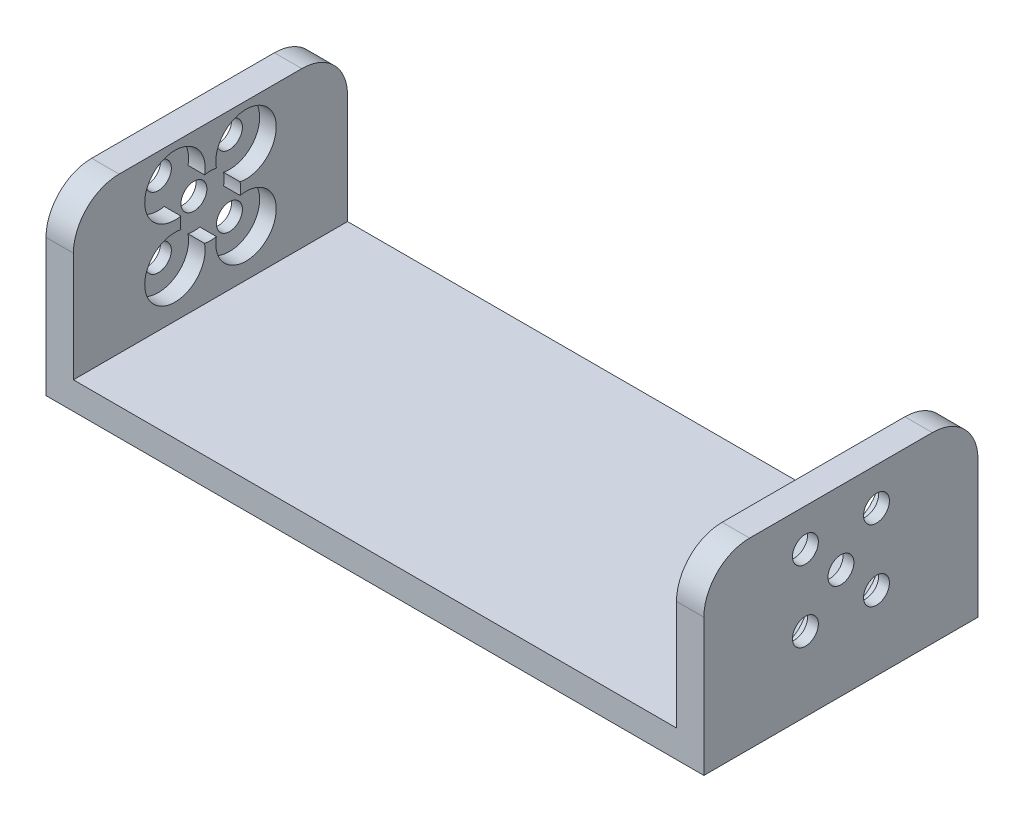
from build123d import *

# Parameters (mm, degrees)
SKETCH1_W                                        = 91.44
SKETCH1_H                                        = 38.1
BOSS_EXTRUDE1_DEPTH                              = 3.81
SKETCH2_W                                        = 38.1
SKETCH2_H                                        = 25.4
BOSS_EXTRUDE2_DEPTH                              = 3.81
CBORE_FOR_M3_HEX_HEAD_MACHINE_SCREW1_D           = 3.6
CBORE_FOR_M3_HEX_HEAD_MACHINE_SCREW1_DEPTH       = 3.81
CBORE_FOR_M3_HEX_HEAD_MACHINE_SCREW1_CBORE_D     = 8.4
CBORE_FOR_M3_HEX_HEAD_MACHINE_SCREW1_CBORE_DEPTH = 2.3
FILLET1_R                                        = 6.35
FILLET1_OF_MIRROR1_R                             = 6.35


with BuildPart() as part:
    # Sketch1 → Boss-Extrude1 (new body)
    with BuildSketch(Plane(origin=(0, 0, 0), x_dir=(1, 0, 0), z_dir=(0, 1, 0))):
        Rectangle(SKETCH1_W, SKETCH1_H)
    extrude(amount=BOSS_EXTRUDE1_DEPTH)

    # Sketch2 → Boss-Extrude2 (add)
    with BuildSketch(Plane.ZY.offset(45.72)):
        with Locations((0, 12.7)):
            Rectangle(SKETCH2_W, SKETCH2_H)
    boss_extrude2 = extrude(amount=-BOSS_EXTRUDE2_DEPTH)

    # CBORE for M3 Hex Head Machine Screw1
    with Locations(Plane(origin=(-41.91, 0, 0), x_dir=(0, 0, -1), z_dir=(1, 0, 0))):
        with Locations((-4.939140867, 20.179140867), (4.939140867, 20.179140867), (0, 15.24), (-4.939140867, 10.300859133), (4.939140867, 10.300859133)):
            cbore_for_m3_hex_head_machine_screw1 = CounterBoreHole(CBORE_FOR_M3_HEX_HEAD_MACHINE_SCREW1_D / 2, CBORE_FOR_M3_HEX_HEAD_MACHINE_SCREW1_CBORE_D / 2, CBORE_FOR_M3_HEX_HEAD_MACHINE_SCREW1_CBORE_DEPTH, depth=CBORE_FOR_M3_HEX_HEAD_MACHINE_SCREW1_DEPTH)

    # Fillet1
    fillet1_edges = [part.edges().sort_by_distance(p)[0] for p in [
        (-43.815, 25.4, -19.05),
        (-43.815, 25.4, 19.05),
    ]]
    fillet(fillet1_edges, radius=FILLET1_R)

    # Mirror1: Boss-Extrude2, CBORE for M3 Hex Head Machine Screw1 across plane
    add(boss_extrude2.mirror(Plane(origin=(0, 0, 0), x_dir=(0, 0, 1), z_dir=(1, 0, 0))))
    add(cbore_for_m3_hex_head_machine_screw1.mirror(Plane(origin=(0, 0, 0), x_dir=(0, 0, 1), z_dir=(1, 0, 0))), mode=Mode.SUBTRACT)

    # Fillet1 of Mirror1
    fillet1_of_mirror1_edges = [part.edges().sort_by_distance(p)[0] for p in [
        (43.815, 25.4, -19.05),
        (43.815, 25.4, 19.05),
    ]]
    fillet(fillet1_of_mirror1_edges, radius=FILLET1_OF_MIRROR1_R)


solid = part.part
